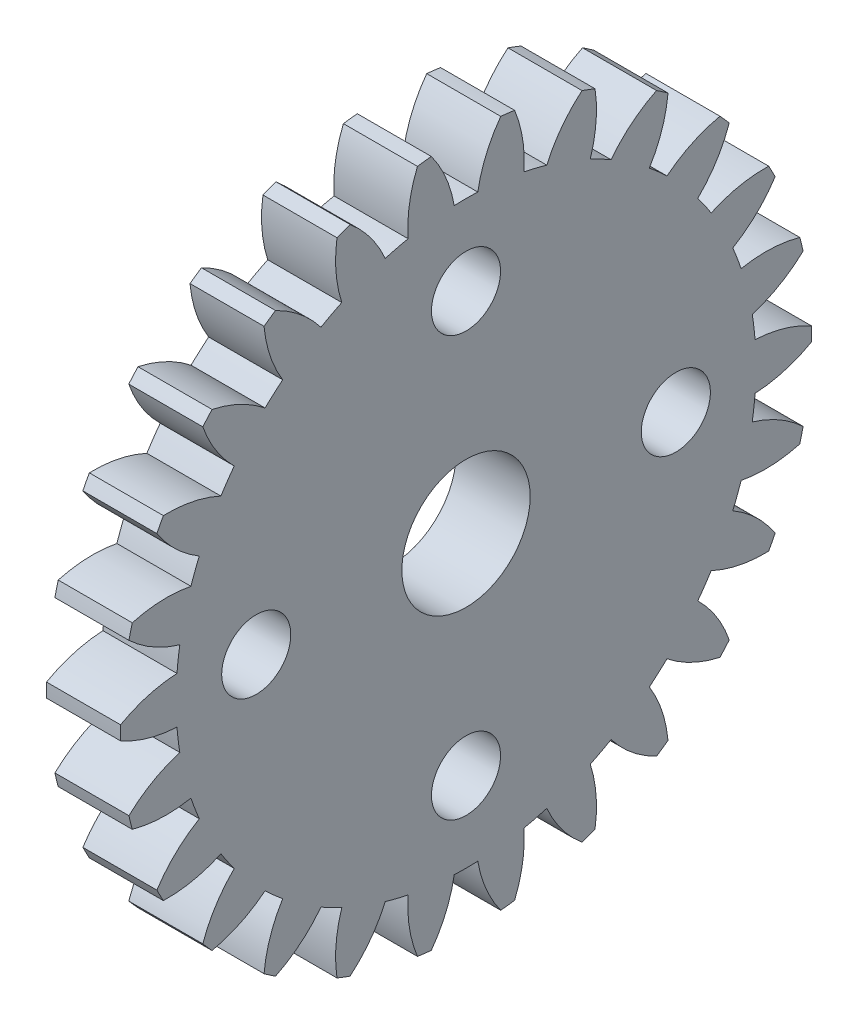
from build123d import *

# Parameters (mm, degrees)
BASPROSKE_W         = 5
BASPROSKE_H         = 14
TOOTHCUT_DEPTH      = 21.420577857
TEETHCUTS_COUNT     = 26
TEETHCUTS_ANGLE     = 346.153846154
BORSKE_R            = 0.4
BORE_DEPTH          = 50.0000508
SKETCH_2_R          = 2.6
CUT_EXTRUDE_2_DEPTH = 10
SKETCH_3_R          = 1.5
CUT_EXTRUDE_3_DEPTH = 10
SKETCH_4_R          = 1.5
SKETCH_4_R_2        = 1.3
EXTRUDE_1_DEPTH     = 5
SKETCH_6_R          = 2.6
SKETCH_6_R_2        = 1.3
CUT_EXTRUDE_4_DEPTH = 2
SKETCH_7_R          = 1.4
CUT_EXTRUDE_5_DEPTH = 10


with BuildPart() as part:
    # BasProSke → Base-Revolve (revolve)
    with BuildSketch(Plane(origin=(0, 0, 0), x_dir=(1, 0, 0), z_dir=(0, 1, 0)), mode=Mode.PRIVATE) as base_revolve_sk:
        with Locations((2.5, 7)):
            Rectangle(BASPROSKE_W, BASPROSKE_H)
    revolve(base_revolve_sk.sketch.rotate(Axis((-10, 0, 0), (1, 0, 0)), 180), axis=Axis((-10, 0, 0), (1, 0, 0)))

    # TooCutSke → ToothCut (cut, through all)
    with BuildSketch(Plane(origin=(0, 0, 0), x_dir=(0, 0, -1), z_dir=(1, 0, 0))):
        with BuildLine():
            ThreePointArc((0.476965065, 11.739314517), (0, 11.749), (-0.476965065, 11.739314517))
            ThreePointArc((-0.476965065, 11.739314517), (-0.82065865, 12.901686978), (-1.424117301, 13.952911348))
            ThreePointArc((-1.424117301, 13.952911348), (0, 14.0254), (1.424117301, 13.952911348))
            ThreePointArc((1.424117301, 13.952911348), (0.82065865, 12.901686978), (0.476965065, 11.739314517))
        make_face()
    toothcut = extrude(amount=TOOTHCUT_DEPTH, mode=Mode.SUBTRACT)

    # TeethCuts: ToothCut ×26 about axis
    teethcuts_axis = Axis((-10, 0, 0), (1, 0, 0))
    for i in range(1, TEETHCUTS_COUNT):
        add(toothcut.rotate(teethcuts_axis, i * TEETHCUTS_ANGLE / (TEETHCUTS_COUNT - 1)), mode=Mode.SUBTRACT)

    # BorSke → Bore (cut, symmetric)
    with BuildSketch(Plane(origin=(0, 0, 0), x_dir=(0, 0, -1), z_dir=(1, 0, 0))):
        with Locations(Location((0, 0, 0), (0, 0, 180))):
            Circle(BORSKE_R)
    extrude(amount=BORE_DEPTH, both=True, mode=Mode.SUBTRACT)

    # 草图2 → 切除-拉伸2 (cut)
    with BuildSketch(Plane(origin=(5, 0, 0), x_dir=(0, 0, -1), z_dir=(1, 0, 0))):
        Circle(SKETCH_2_R)
    extrude(amount=-CUT_EXTRUDE_2_DEPTH, mode=Mode.SUBTRACT)

    # 草图3 → 切除-拉伸3 (cut)
    with BuildSketch(Plane.ZY):
        with Locations((0, 8.5)):
            Circle(SKETCH_3_R)
        with Locations((-8.5, 0)):
            Circle(SKETCH_3_R)
        with Locations((0, -8.5)):
            Circle(SKETCH_3_R)
        with Locations((8.5, 0)):
            Circle(SKETCH_3_R)
    extrude(amount=-CUT_EXTRUDE_3_DEPTH, mode=Mode.SUBTRACT)

    # 草图4 → 凸台-拉伸1 (add)
    # profile 1 of 4: a face of its own
    with BuildSketch(Plane.ZY):
        with Locations((0, 8.5)):
            Circle(SKETCH_4_R)
        with Locations((0, 8.5)):
            Circle(SKETCH_4_R_2, mode=Mode.SUBTRACT)
    # profile 2 of 4: a face of its own
    with BuildSketch(Plane.ZY):
        with Locations((-8.5, 0)):
            Circle(SKETCH_4_R)
        with Locations((-8.5, 0)):
            Circle(SKETCH_4_R_2, mode=Mode.SUBTRACT)
    # profile 3 of 4: a face of its own
    with BuildSketch(Plane.ZY):
        with Locations((8.5, 0)):
            Circle(SKETCH_4_R)
        with Locations((8.5, 0)):
            Circle(SKETCH_4_R_2, mode=Mode.SUBTRACT)
    # profile 4 of 4: a face of its own
    with BuildSketch(Plane.ZY):
        with Locations((0, -8.5)):
            Circle(SKETCH_4_R)
        with Locations((0, -8.5)):
            Circle(SKETCH_4_R_2, mode=Mode.SUBTRACT)
    extrude(amount=-EXTRUDE_1_DEPTH)

    # 草图6 → 切除-拉伸4 (cut)
    with BuildSketch(Plane.ZY):
        with BuildLine():
            ThreePointArc((11.711213482, -0.941530547), (12.892368176, -0.744557757), (13.997147102, -0.282618132))
            ThreePointArc((13.997147102, -0.282618132), (14, 0), (13.997147102, 0.282618132))
            ThreePointArc((13.997147102, 0.282618132), (12.892368176, 0.744557757), (11.711213482, 0.941530547))
            ThreePointArc((11.711213482, 0.941530547), (11.663336562, 1.416185456), (11.596229911, 1.888505453))
            ThreePointArc((11.596229911, 1.888505453), (12.695923722, 2.362423393), (13.658050392, 3.075330794))
            ThreePointArc((13.658050392, 3.075330794), (13.593185444, 3.3504193), (13.5227805, 3.62414232))
            ThreePointArc((13.5227805, 3.62414232), (12.339555054, 3.808267916), (11.145583894, 3.716848215))
            ThreePointArc((11.145583894, 3.716848215), (10.985505835, 4.166252818), (10.807315608, 4.608788382))
            ThreePointArc((10.807315608, 4.608788382), (11.761638329, 5.332109082), (12.525197438, 6.254552673))
            ThreePointArc((12.525197438, 6.254552673), (12.396384359, 6.506124409), (12.262519049, 6.755044529))
            ThreePointArc((12.262519049, 6.755044529), (11.069611844, 6.650655386), (9.932213483, 6.276156174))
            ThreePointArc((9.932213483, 6.276156174), (9.66923744, 6.674192709), (9.390319405, 7.061225281))
            ThreePointArc((9.390319405, 7.061225281), (10.143809268, 7.991911973), (10.664425536, 9.070282685))
            ThreePointArc((10.664425536, 9.070282685), (10.479150474, 9.283717215), (10.289604563, 9.493368103))
            ThreePointArc((10.289604563, 9.493368103), (9.156343031, 9.10653094), (8.141618926, 8.47071675))
            ThreePointArc((8.141618926, 8.47071675), (7.791028112, 8.79425278), (7.42759197, 9.103289434))
            ThreePointArc((7.42759197, 9.103289434), (7.936458884, 10.187253989), (8.183875986, 11.358880836))
            ThreePointArc((8.183875986, 11.358880836), (7.952906454, 11.521774123), (7.718695661, 11.679971631))
            ThreePointArc((7.718695661, 11.679971631), (6.710940842, 11.033168016), (5.877863071, 10.172990058))
            ThreePointArc((5.877863071, 10.172990058), (5.460032548, 10.403222845), (5.033199889, 10.616303494))
            ThreePointArc((5.033199889, 10.616303494), (5.267870357, 11.790549832), (5.227709311, 12.987342121))
            ThreePointArc((5.227709311, 12.987342121), (4.964468419, 13.090227398), (4.699204223, 13.187777662))
            ThreePointArc((4.699204223, 13.187777662), (3.875523165, 12.318597471), (3.272507179, 11.284046161))
            ThreePointArc((3.272507179, 11.284046161), (2.81171974, 11.407595413), (2.346296524, 11.512336584))
            ThreePointArc((2.346296524, 11.512336584), (2.293132353, 12.708621777), (1.967727172, 13.861026289))
            ThreePointArc((1.967727172, 13.861026289), (1.687513524, 13.897924237), (1.406612117, 13.929157991))
            ThreePointArc((1.406612117, 13.929157991), (0.814874168, 12.888114817), (0.476965065, 11.739314517))
            ThreePointArc((0.476965065, 11.739314517), (0, 11.749), (-0.476965065, 11.739314517))
            ThreePointArc((-0.476965065, 11.739314517), (-0.814874168, 12.888114817), (-1.406612117, 13.929157991))
            ThreePointArc((-1.406612117, 13.929157991), (-1.687513524, 13.897924237), (-1.967727172, 13.861026289))
            ThreePointArc((-1.967727172, 13.861026289), (-2.293132353, 12.708621777), (-2.346296524, 11.512336584))
            ThreePointArc((-2.346296524, 11.512336584), (-2.81171974, 11.407595413), (-3.272507179, 11.284046161))
            ThreePointArc((-3.272507179, 11.284046161), (-3.875523165, 12.318597471), (-4.699204223, 13.187777662))
            ThreePointArc((-4.699204223, 13.187777662), (-4.964468419, 13.090227398), (-5.227709311, 12.987342121))
            ThreePointArc((-5.227709311, 12.987342121), (-5.267870357, 11.790549832), (-5.033199889, 10.616303494))
            ThreePointArc((-5.033199889, 10.616303494), (-5.460032548, 10.403222845), (-5.877863071, 10.172990058))
            ThreePointArc((-5.877863071, 10.172990058), (-6.710940842, 11.033168016), (-7.718695661, 11.679971631))
            ThreePointArc((-7.718695661, 11.679971631), (-7.952906454, 11.521774123), (-8.183875986, 11.358880836))
            ThreePointArc((-8.183875986, 11.358880836), (-7.936458884, 10.187253989), (-7.42759197, 9.103289434))
            ThreePointArc((-7.42759197, 9.103289434), (-7.791028112, 8.79425278), (-8.141618926, 8.47071675))
            ThreePointArc((-8.141618926, 8.47071675), (-9.156343031, 9.10653094), (-10.289604563, 9.493368103))
            ThreePointArc((-10.289604563, 9.493368103), (-10.479150474, 9.283717215), (-10.664425536, 9.070282685))
            ThreePointArc((-10.664425536, 9.070282685), (-10.143809268, 7.991911973), (-9.390319405, 7.061225281))
            ThreePointArc((-9.390319405, 7.061225281), (-9.66923744, 6.674192709), (-9.932213483, 6.276156174))
            ThreePointArc((-9.932213483, 6.276156174), (-11.069611844, 6.650655386), (-12.262519049, 6.755044529))
            ThreePointArc((-12.262519049, 6.755044529), (-12.396384359, 6.506124409), (-12.525197438, 6.254552673))
            ThreePointArc((-12.525197438, 6.254552673), (-11.761638329, 5.332109082), (-10.807315608, 4.608788382))
            ThreePointArc((-10.807315608, 4.608788382), (-10.985505835, 4.166252818), (-11.145583894, 3.716848215))
            ThreePointArc((-11.145583894, 3.716848215), (-12.339555054, 3.808267916), (-13.5227805, 3.62414232))
            ThreePointArc((-13.5227805, 3.62414232), (-13.593185444, 3.3504193), (-13.658050392, 3.075330794))
            ThreePointArc((-13.658050392, 3.075330794), (-12.695923722, 2.362423393), (-11.596229911, 1.888505453))
            ThreePointArc((-11.596229911, 1.888505453), (-11.663336562, 1.416185456), (-11.711213482, 0.941530547))
            ThreePointArc((-11.711213482, 0.941530547), (-12.892368176, 0.744557757), (-13.997147102, 0.282618132))
            ThreePointArc((-13.997147102, 0.282618132), (-14, 0), (-13.997147102, -0.282618132))
            ThreePointArc((-13.997147102, -0.282618132), (-12.892368176, -0.744557757), (-11.711213482, -0.941530547))
            ThreePointArc((-11.711213482, -0.941530547), (-11.663336562, -1.416185456), (-11.596229911, -1.888505453))
            ThreePointArc((-11.596229911, -1.888505453), (-12.695923722, -2.362423393), (-13.658050392, -3.075330794))
            ThreePointArc((-13.658050392, -3.075330794), (-13.593185444, -3.3504193), (-13.5227805, -3.62414232))
            ThreePointArc((-13.5227805, -3.62414232), (-12.339555054, -3.808267916), (-11.145583894, -3.716848215))
            ThreePointArc((-11.145583894, -3.716848215), (-10.985505835, -4.166252818), (-10.807315608, -4.608788382))
            ThreePointArc((-10.807315608, -4.608788382), (-11.761638329, -5.332109082), (-12.525197438, -6.254552673))
            ThreePointArc((-12.525197438, -6.254552673), (-12.396384359, -6.506124409), (-12.262519049, -6.755044529))
            ThreePointArc((-12.262519049, -6.755044529), (-11.069611844, -6.650655386), (-9.932213483, -6.276156174))
            ThreePointArc((-9.932213483, -6.276156174), (-9.66923744, -6.674192709), (-9.390319405, -7.061225281))
            ThreePointArc((-9.390319405, -7.061225281), (-10.143809268, -7.991911973), (-10.664425536, -9.070282685))
            ThreePointArc((-10.664425536, -9.070282685), (-10.479150474, -9.283717215), (-10.289604563, -9.493368103))
            ThreePointArc((-10.289604563, -9.493368103), (-9.156343031, -9.10653094), (-8.141618926, -8.47071675))
            ThreePointArc((-8.141618926, -8.47071675), (-7.791028112, -8.79425278), (-7.42759197, -9.103289434))
            ThreePointArc((-7.42759197, -9.103289434), (-7.936458884, -10.187253989), (-8.183875986, -11.358880836))
            ThreePointArc((-8.183875986, -11.358880836), (-7.952906454, -11.521774123), (-7.718695661, -11.679971631))
            ThreePointArc((-7.718695661, -11.679971631), (-6.710940842, -11.033168016), (-5.877863071, -10.172990058))
            ThreePointArc((-5.877863071, -10.172990058), (-5.460032548, -10.403222845), (-5.033199889, -10.616303494))
            ThreePointArc((-5.033199889, -10.616303494), (-5.267870357, -11.790549832), (-5.227709311, -12.987342121))
            ThreePointArc((-5.227709311, -12.987342121), (-4.964468419, -13.090227398), (-4.699204223, -13.187777662))
            ThreePointArc((-4.699204223, -13.187777662), (-3.875523165, -12.318597471), (-3.272507179, -11.284046161))
            ThreePointArc((-3.272507179, -11.284046161), (-2.81171974, -11.407595413), (-2.346296524, -11.512336584))
            ThreePointArc((-2.346296524, -11.512336584), (-2.293132353, -12.708621777), (-1.967727172, -13.861026289))
            ThreePointArc((-1.967727172, -13.861026289), (-1.687513524, -13.897924237), (-1.406612117, -13.929157991))
            ThreePointArc((-1.406612117, -13.929157991), (-0.814874168, -12.888114817), (-0.476965065, -11.739314517))
            ThreePointArc((-0.476965065, -11.739314517), (0, -11.749), (0.476965065, -11.739314517))
            ThreePointArc((0.476965065, -11.739314517), (0.814874168, -12.888114817), (1.406612117, -13.929157991))
            ThreePointArc((1.406612117, -13.929157991), (1.687513524, -13.897924237), (1.967727172, -13.861026289))
            ThreePointArc((1.967727172, -13.861026289), (2.293132353, -12.708621777), (2.346296524, -11.512336584))
            ThreePointArc((2.346296524, -11.512336584), (2.81171974, -11.407595413), (3.272507179, -11.284046161))
            ThreePointArc((3.272507179, -11.284046161), (3.875523165, -12.318597471), (4.699204223, -13.187777662))
            ThreePointArc((4.699204223, -13.187777662), (4.964468419, -13.090227398), (5.227709311, -12.987342121))
            ThreePointArc((5.227709311, -12.987342121), (5.267870357, -11.790549832), (5.033199889, -10.616303494))
            ThreePointArc((5.033199889, -10.616303494), (5.460032548, -10.403222845), (5.877863071, -10.172990058))
            ThreePointArc((5.877863071, -10.172990058), (6.710940842, -11.033168016), (7.718695661, -11.679971631))
            ThreePointArc((7.718695661, -11.679971631), (7.952906454, -11.521774123), (8.183875986, -11.358880836))
            ThreePointArc((8.183875986, -11.358880836), (7.936458884, -10.187253989), (7.42759197, -9.103289434))
            ThreePointArc((7.42759197, -9.103289434), (7.791028112, -8.79425278), (8.141618926, -8.47071675))
            ThreePointArc((8.141618926, -8.47071675), (9.156343031, -9.10653094), (10.289604563, -9.493368103))
            ThreePointArc((10.289604563, -9.493368103), (10.479150474, -9.283717215), (10.664425536, -9.070282685))
            ThreePointArc((10.664425536, -9.070282685), (10.143809268, -7.991911973), (9.390319405, -7.061225281))
            ThreePointArc((9.390319405, -7.061225281), (9.66923744, -6.674192709), (9.932213483, -6.276156174))
            ThreePointArc((9.932213483, -6.276156174), (11.069611844, -6.650655386), (12.262519049, -6.755044529))
            ThreePointArc((12.262519049, -6.755044529), (12.396384359, -6.506124409), (12.525197438, -6.254552673))
            ThreePointArc((12.525197438, -6.254552673), (11.761638329, -5.332109082), (10.807315608, -4.608788382))
            ThreePointArc((10.807315608, -4.608788382), (10.985505835, -4.166252818), (11.145583894, -3.716848215))
            ThreePointArc((11.145583894, -3.716848215), (12.339555054, -3.808267916), (13.5227805, -3.62414232))
            ThreePointArc((13.5227805, -3.62414232), (13.593185444, -3.3504193), (13.658050392, -3.075330794))
            ThreePointArc((13.658050392, -3.075330794), (12.695923722, -2.362423393), (11.596229911, -1.888505453))
            ThreePointArc((11.596229911, -1.888505453), (11.663336562, -1.416185456), (11.711213482, -0.941530547))
        make_face()
        with Locations(Location((0, 0, 0), (0, 0, 180))):
            Circle(SKETCH_6_R, mode=Mode.SUBTRACT)
        with Locations((8.5, 0)):
            Circle(SKETCH_6_R_2, mode=Mode.SUBTRACT)
        with Locations((0, -8.5)):
            Circle(SKETCH_6_R_2, mode=Mode.SUBTRACT)
        with Locations((-8.5, 0)):
            Circle(SKETCH_6_R_2, mode=Mode.SUBTRACT)
        with Locations((0, 8.5)):
            Circle(SKETCH_6_R_2, mode=Mode.SUBTRACT)
    extrude(amount=-CUT_EXTRUDE_4_DEPTH, mode=Mode.SUBTRACT)

    # 草图7 → 切除-拉伸5 (cut)
    with BuildSketch(Plane.ZY.offset(-2)):
        with Locations((-8.5, 0)):
            Circle(SKETCH_7_R)
        with Locations((0, 8.5)):
            Circle(SKETCH_7_R)
        with Locations((8.5, 0)):
            Circle(SKETCH_7_R)
        with Locations((0, -8.5)):
            Circle(SKETCH_7_R)
    extrude(amount=-CUT_EXTRUDE_5_DEPTH, mode=Mode.SUBTRACT)


solid = part.part
